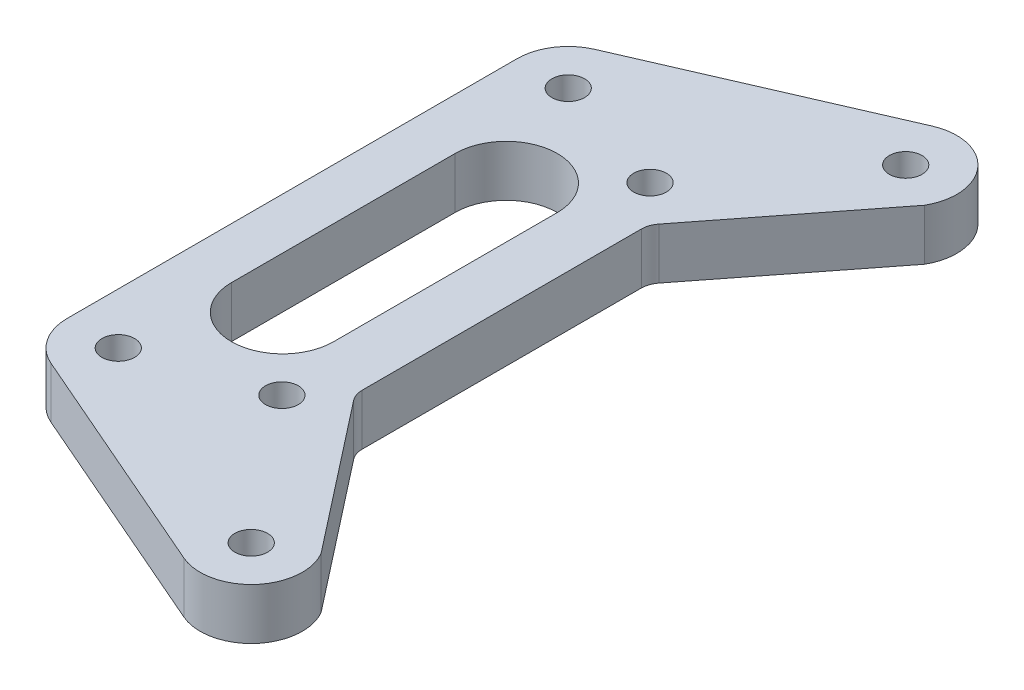
from build123d import *

# Parameters (mm, degrees)
SKIZZE1_R                       = 1.6
AUFSATZ_LINEAR_AUSTRAGEN1_DEPTH = 5
SKIZZE2_R                       = 3
SCHNITT_LINEAR_AUSTRAGEN1_DEPTH = 2.5


with BuildPart() as part:
    # Skizze1 → Aufsatz-Linear austragen1 (new body)
    with BuildSketch(Plane(origin=(0, 0, 0), x_dir=(1, 0, 0), z_dir=(0, 1, 0))):
        with BuildLine():
            Line((-11.407603893, 26.585350281), (11.592396107, 36.585350281))
            ThreePointArc((11.592396107, 36.585350281), (17.315272821, 35.330573989), (17.917777995, 29.502815505))
            Line((17.917777995, 29.502815505), (6.526122928, 14.921747017))
            ThreePointArc((6.526122928, 14.921747017), (6.199926496, 14.320953091), (6.087096426, 13.646692883))
            Line((6.087096426, 13.646692883), (6.087096426, -13.646692883))
            ThreePointArc((6.087096426, -13.646692883), (6.199926496, -14.320953091), (6.526122928, -14.921747017))
            Line((6.526122928, -14.921747017), (17.917777995, -29.502815505))
            ThreePointArc((17.917777995, -29.502815505), (17.315272821, -35.330573989), (11.592396107, -36.585350281))
            Line((11.592396107, -36.585350281), (-11.407603893, -26.585350281))
            ThreePointArc((-11.407603893, -26.585350281), (-13.595369801, -24.741518486), (-14.413973336, -22))
            Line((-14.413973336, -22), (-14.413973336, 22))
            ThreePointArc((-14.413973336, 22), (-13.595369801, 24.741518486), (-11.407603893, 26.585350281))
        make_face()
        with Locations(Location((-9.413973336, 22, 0), (0, 0, 270))):
            Circle(SKIZZE1_R, mode=Mode.SUBTRACT)
        with Locations(Location((13.586026664, 32, 0), (0, 0, 270))):
            Circle(SKIZZE1_R, mode=Mode.SUBTRACT)
        with Locations(Location((2.586026664, 18, 0), (0, 0, 270))):
            Circle(SKIZZE1_R, mode=Mode.SUBTRACT)
        with Locations(Location((2.586026664, -18, 0), (0, 0, 90))):
            Circle(SKIZZE1_R, mode=Mode.SUBTRACT)
        with Locations(Location((13.586026664, -32, 0), (0, 0, 90))):
            Circle(SKIZZE1_R, mode=Mode.SUBTRACT)
        with Locations(Location((-9.413973336, -22, 0), (0, 0, 90))):
            Circle(SKIZZE1_R, mode=Mode.SUBTRACT)
        with BuildLine():
            Line((-9.413973336, 10.935684827), (-9.413973336, -10.935684827))
            ThreePointArc((-9.413973336, -10.935684827), (-4.413973336, -15.935684827), (0.586026664, -10.935684827))
            Line((0.586026664, -10.935684827), (0.586026664, 10.935684827))
            ThreePointArc((0.586026664, 10.935684827), (-4.413973336, 15.935684827), (-9.413973336, 10.935684827))
        make_face(mode=Mode.SUBTRACT)
    extrude(amount=AUFSATZ_LINEAR_AUSTRAGEN1_DEPTH)

    # Skizze2 → Schnitt-Linear austragen1 (cut)
    with BuildSketch(Plane.XZ):
        with Locations(Location((2.586026664, -18, 0), (0, 0, 270))):
            Circle(SKIZZE2_R)
        with Locations(Location((2.586026664, 18, 0), (0, 0, 270))):
            Circle(SKIZZE2_R)
    extrude(amount=-SCHNITT_LINEAR_AUSTRAGEN1_DEPTH, mode=Mode.SUBTRACT)


solid = part.part
